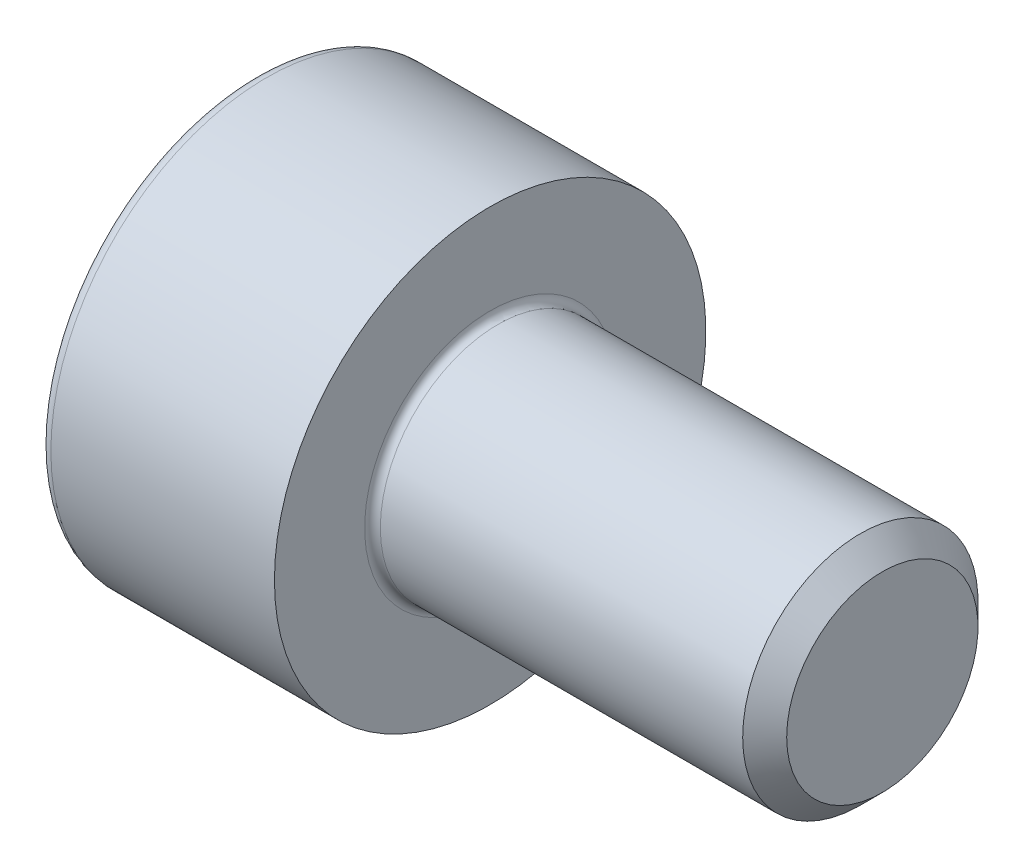
from build123d import *

# Parameters (mm, degrees)
FILLET1_R   = 0.1
FILLET2_R   = 0.15
HEX_2_DEPTH = 1.3


with BuildPart() as part:
    # BodySke → Base-Revolve (revolve)
    with BuildSketch(Plane.XY, mode=Mode.PRIVATE) as base_revolve_sk:
        Polygon((0, 0), (0, 2.75), (3, 2.75), (3, 1.5), (7.7195, 1.5), (8, 1.2195), (8, 0), align=None)
    revolve(base_revolve_sk.sketch.rotate(Axis((-31.75, 0, 0), (1, 0, 0)), 90), axis=Axis((-31.75, 0, 0), (1, 0, 0)))

    # Fillet1
    fillet1_edges = [part.edges().sort_by_distance(p)[0] for p in [
        (3, 0, -1.5),
    ]]
    fillet(fillet1_edges, radius=FILLET1_R)

    # Fillet2
    fillet2_edges = [part.edges().sort_by_distance(p)[0] for p in [
        (0, 0, -2.75),
    ]]
    fillet(fillet2_edges, radius=FILLET2_R)

    # Sketch2 → Hex-PreBroach (revolve, cut)
    with BuildSketch(Plane.XY, mode=Mode.PRIVATE) as hex_prebroach_sk:
        Polygon((0, 1.28), (1.3, 1.28), (2.039008345, 0), (0, 0), align=None)
    revolve(hex_prebroach_sk.sketch.rotate(Axis((0, 0, 0), (1, 0, 0)), 90), axis=Axis((0, 0, 0), (1, 0, 0)), mode=Mode.SUBTRACT)

    # Sketch3 → Hex 2 (cut)
    with BuildSketch(Plane(origin=(0, 0, 0), x_dir=(0, 0.500000000000001, 0.866025403784438), z_dir=(-1, 0, 0))):
        Polygon((0.739008345, 1.28), (-0.739008345, 1.28), (-1.478016689, 0), (-0.739008345, -1.28), (0.739008345, -1.28), (1.478016689, 0), align=None)
    extrude(amount=-HEX_2_DEPTH, mode=Mode.SUBTRACT)


solid = part.part
